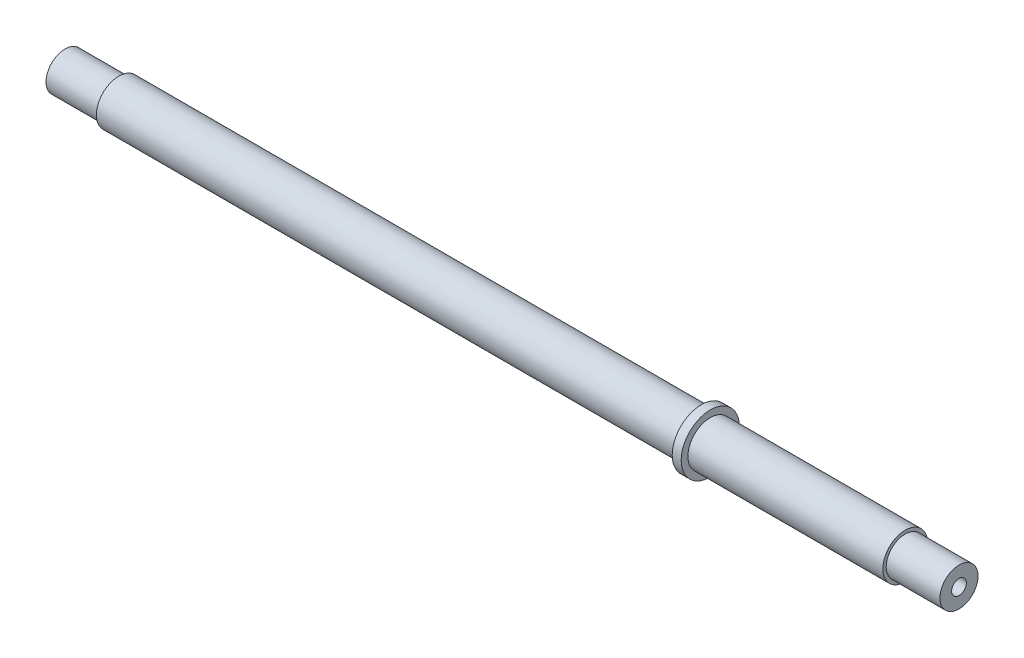
from build123d import *


with BuildPart() as part:
    # Sketch2 → Revolve1 (revolve)
    with BuildSketch(Plane(origin=(0, 0, 0), x_dir=(1, 0, 0), z_dir=(0, 1, 0)), mode=Mode.PRIVATE) as revolve1_sk:
        Polygon((-99.75, 4.25), (-87.75, 4.25), (-87.75, 5), (42.25, 5), (42.25, 6.5), (44.25, 6.5), (44.25, 5), (87.75, 5), (87.75, 4.25), (99.75, 4.25), (99.75, 0), (-99.75, 0), align=None)
    revolve(revolve1_sk.sketch.rotate(Axis((-69.609903496, 0, 0), (1, 0, 0)), 180), axis=Axis((-69.609903496, 0, 0), (1, 0, 0)))

    # Sketch5 → M4x0.7 Tapped Hole1 (revolve, cut)
    with BuildSketch(Plane(origin=(99.75, 0, 0), x_dir=(0, 0, -1), z_dir=(0, 1, 0))):
        Polygon((0, 0), (0, 15.991420021), (1.65, 15), (1.65, 0), align=None)
    m4x0_7_tapped_hole1 = revolve(axis=Axis((106.1, 0, 0), (-1, 0, 0)), mode=Mode.SUBTRACT)

    # Mirror1: M4x0.7 Tapped Hole1 across plane
    add(m4x0_7_tapped_hole1.mirror(Plane(origin=(0, 0, 0), x_dir=(0, 0, 1), z_dir=(1, 0, 0))), mode=Mode.SUBTRACT)


solid = part.part
